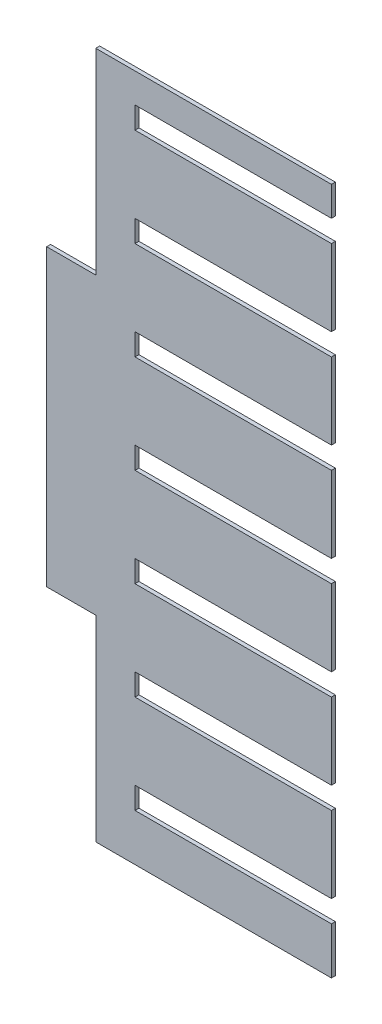
from build123d import *

# Parameters (mm, degrees)
BOSS_EXTRUDE1_DEPTH = 2
SKETCH2_W           = 100
SKETCH2_H           = 11.123940721
CUT_EXTRUDE1_DEPTH  = 2
LPATTERN1_COUNT     = 7
LPATTERN1_PITCH     = 50
CUT_EXTRUDE2_REACH  = 249.495
SKETCH4_W           = 15
SKETCH4_H           = 350


with BuildPart() as part:
    # Sketch1 → Boss-Extrude1 (new body)
    with BuildSketch(Plane.XY):
        Polygon((-15, -175), (-15, 175), (-150, 175), (-150, 75), (-175, 75), (-175, -75), (-150, -75), (-150, -175), align=None)
    extrude(amount=BOSS_EXTRUDE1_DEPTH)

    # Sketch2 → Cut-Extrude1 (cut)
    with BuildSketch(Plane.XY.offset(2)):
        with Locations((-80, 154.43802964)):
            Rectangle(SKETCH2_W, SKETCH2_H)
    cut_extrude1 = extrude(amount=-CUT_EXTRUDE1_DEPTH, mode=Mode.SUBTRACT)

    # LPattern1: Cut-Extrude1 ×7
    with Locations(*[(0, -i * LPATTERN1_PITCH, 0) for i in range(1, LPATTERN1_COUNT)]):
        add(cut_extrude1, mode=Mode.SUBTRACT)

    # Sketch4 → Cut-Extrude2 (cut, up to next)
    with BuildSketch(Plane.XY.offset(2), mode=Mode.PRIVATE) as cut_extrude2_sk1:
        with Locations((-22.5, 0)):
            Rectangle(SKETCH4_W, SKETCH4_H)
    cut_extrude2_tool1 = extrude(cut_extrude2_sk1.sketch, amount=-CUT_EXTRUDE2_REACH, mode=Mode.PRIVATE) & part.part
    add(cut_extrude2_tool1.solids().sort_by_distance((-22.5, 0, 2))[0], mode=Mode.SUBTRACT)


solid = part.part
